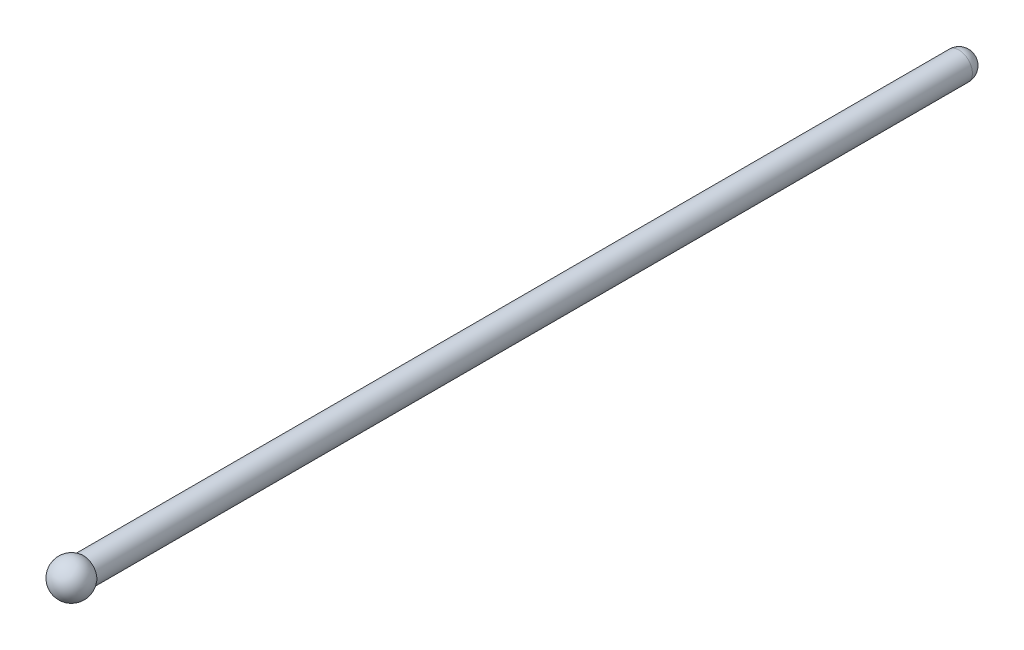
from build123d import *

# Parameters (mm, degrees)
SKETCH1_R           = 0.75
BOSS_EXTRUDE1_DEPTH = 50
FILLET1_R           = 0.75


with BuildPart() as part:
    # Sketch1 → Boss-Extrude1 (new body)
    with BuildSketch(Plane.XY):
        Circle(SKETCH1_R)
    extrude(amount=BOSS_EXTRUDE1_DEPTH)

    # Sketch2 → Revolve1 (revolve)
    with BuildSketch(Plane.XY.offset(50)):
        with BuildLine():
            Line((-1, 0), (1, 0))
            ThreePointArc((1, 0), (0, 1), (-1, 0))
        make_face()
    revolve(axis=Axis((-1, 0, 50), (1, 0, 0)))

    # Fillet1
    fillet1_edges = [part.edges().sort_by_distance(p)[0] for p in [
        (-0.75, 0, 0),
    ]]
    fillet(fillet1_edges, radius=FILLET1_R)


solid = part.part
